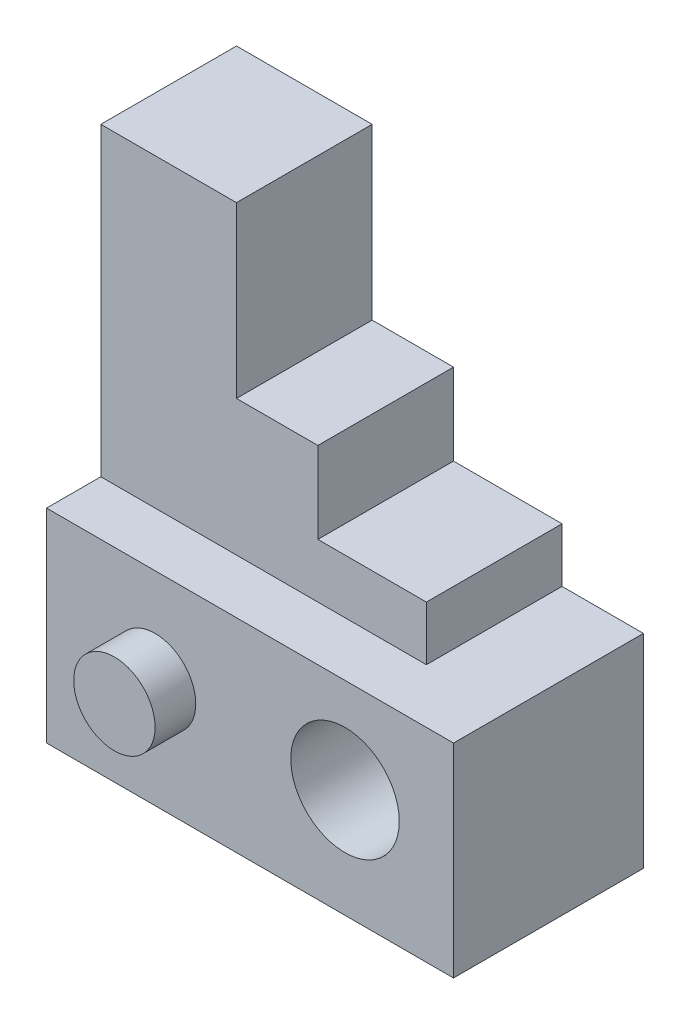
from build123d import *

# Parameters (mm, degrees)
SKETCH1_W           = 60
SKETCH1_H           = 30
SKETCH1_R           = 8
BOSS_EXTRUDE1_DEPTH = 28
BOSS_EXTRUDE2_DEPTH = 20
SKETCH3_R           = 6
BOSS_EXTRUDE3_DEPTH = 6


with BuildPart() as part:
    # Sketch1 → Boss-Extrude1 (new body)
    with BuildSketch(Plane.XY):
        with Locations((30, 15)):
            Rectangle(SKETCH1_W, SKETCH1_H)
        with Locations((44, 16)):
            Circle(SKETCH1_R, mode=Mode.SUBTRACT)
    extrude(amount=BOSS_EXTRUDE1_DEPTH)

    # Sketch2 → Boss-Extrude2 (add)
    with BuildSketch(Plane.XY):
        Polygon((0, 30), (0, 75), (20, 75), (20, 50), (32, 50), (32, 38), (48, 38), (48, 30), align=None)
    extrude(amount=BOSS_EXTRUDE2_DEPTH)

    # Sketch3 → Boss-Extrude3 (add)
    with BuildSketch(Plane.XY.offset(28)):
        with Locations((16, 16)):
            Circle(SKETCH3_R)
    extrude(amount=BOSS_EXTRUDE3_DEPTH)


solid = part.part
